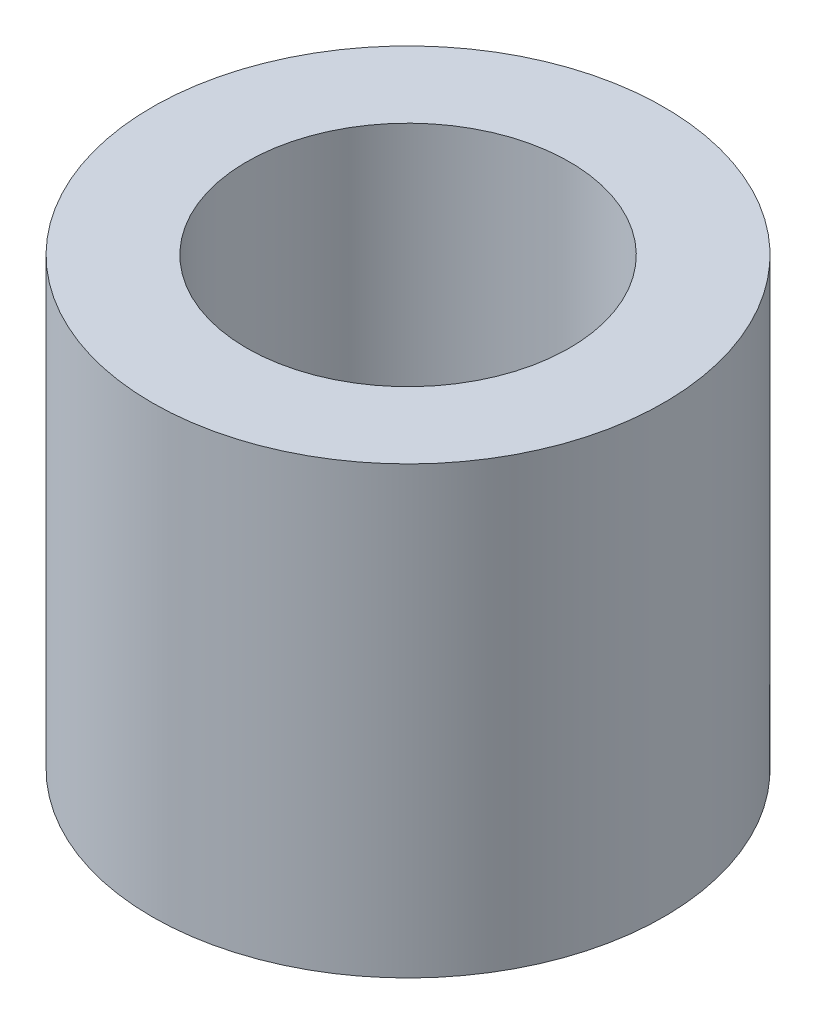
from build123d import *

# Parameters (mm, degrees)
SKETCH_1_R      = 230
SKETCH_1_R_2    = 145
EXTRUDE_1_DEPTH = 400


with BuildPart() as part:
    # 草图1 → 凸台-拉伸1 (new body)
    with BuildSketch(Plane(origin=(0, 0, 0), x_dir=(1, 0, 0), z_dir=(0, 1, 0))):
        with Locations(Location((0, 0, 0), (0, 0, 270))):
            Circle(SKETCH_1_R)
        with Locations(Location((0, 0, 0), (0, 0, 270))):
            Circle(SKETCH_1_R_2, mode=Mode.SUBTRACT)
    extrude(amount=EXTRUDE_1_DEPTH)


solid = part.part
